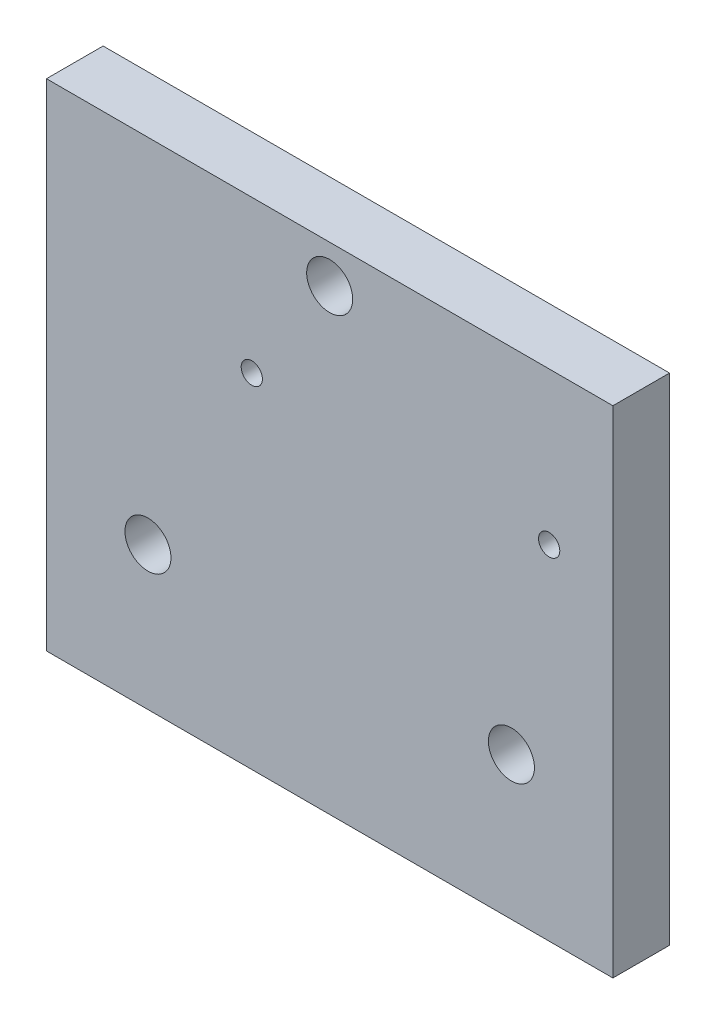
from build123d import *

# Parameters (mm, degrees)
SKETCH1_W           = 160
SKETCH1_H           = 140
BOSS_EXTRUDE1_DEPTH = 16
SKETCH2_R           = 6.5
CUT_EXTRUDE1_DEPTH  = 11
SKETCH3_R           = 3
CUT_EXTRUDE2_DEPTH  = 214.20412754


with BuildPart() as part:
    # Sketch1 → Boss-Extrude1 (new body)
    with BuildSketch(Plane.XY):
        with Locations((-80, -70)):
            Rectangle(SKETCH1_W, SKETCH1_H)
    extrude(amount=BOSS_EXTRUDE1_DEPTH)

    # Sketch2 → Cut-Extrude1 (cut)
    with BuildSketch(Plane.XY.offset(16)):
        with Locations((-131.336336798, -99.63904787)):
            Circle(SKETCH2_R)
        with Locations((-80, -10.721904261)):
            Circle(SKETCH2_R)
        with Locations((-28.663663202, -99.63904787)):
            Circle(SKETCH2_R)
    extrude(amount=-CUT_EXTRUDE1_DEPTH, mode=Mode.SUBTRACT)

    # Sketch3 → Cut-Extrude2 (cut, through all)
    with BuildSketch(Plane.XY.offset(16)):
        with Locations((-18, -43)):
            Circle(SKETCH3_R)
        with Locations((-102, -43)):
            Circle(SKETCH3_R)
    extrude(amount=-CUT_EXTRUDE2_DEPTH, mode=Mode.SUBTRACT)


solid = part.part
